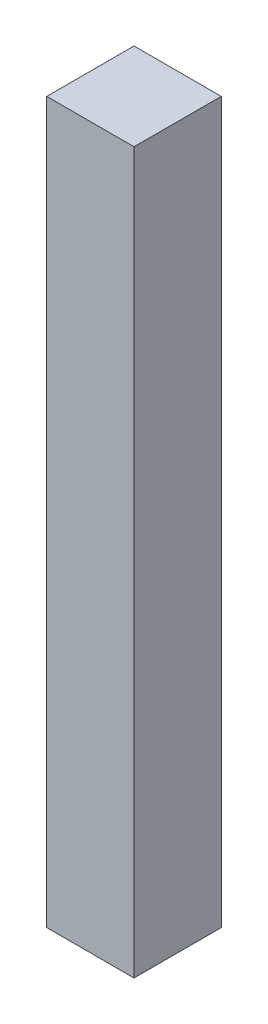
from build123d import *

# Parameters (mm, degrees)
SKETCH2_W           = 40
SKETCH2_H           = 40
BOSS_EXTRUDE1_DEPTH = 330


with BuildPart() as part:
    # Sketch2 → Boss-Extrude1 (new body)
    with BuildSketch(Plane(origin=(0, 0, 0), x_dir=(1, 0, 0), z_dir=(0, 1, 0))):
        Rectangle(SKETCH2_W, SKETCH2_H)
    extrude(amount=BOSS_EXTRUDE1_DEPTH)


solid = part.part
